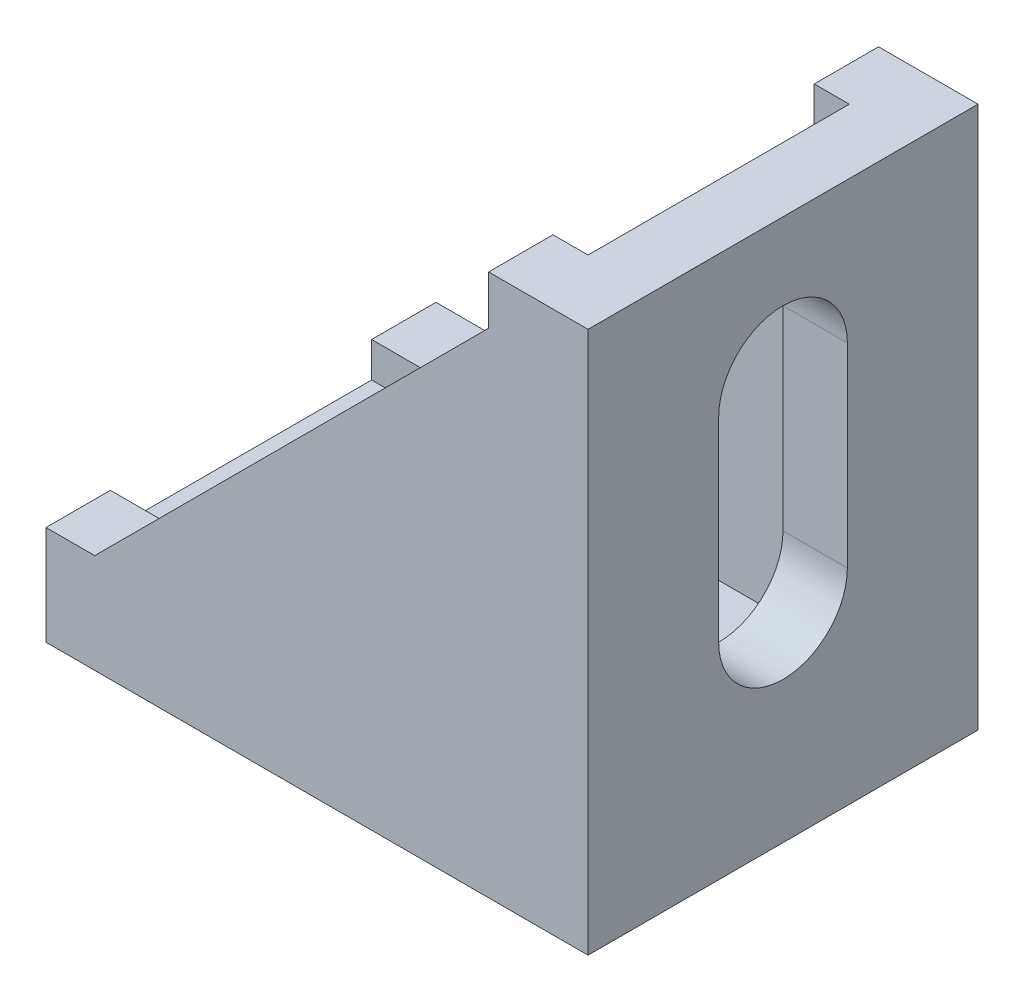
from build123d import *

# Parameters (mm, degrees)
SKETCH_2_W          = 27.8
SKETCH_2_H          = 20
EXTRUDE_1_DEPTH     = 3.3
EXTRUDE_2_DEPTH     = 24.5
CUT_EXTRUDE_1_DEPTH = 24.8
CUT_EXTRUDE_2_DEPTH = 24.8
CUT_EXTRUDE_3_DEPTH = 24.8


with BuildPart() as part:
    # 草图2 → 凸台-拉伸1 (new body)
    with BuildSketch(Plane(origin=(0, 0, 0), x_dir=(1, 0, 0), z_dir=(0, 1, 0))):
        Rectangle(SKETCH_2_W, SKETCH_2_H)
    extrude(amount=EXTRUDE_1_DEPTH)

    # 草图4 → 凸台-拉伸2 (add)
    with BuildSketch(Plane(origin=(0, 3.3, 0), x_dir=(1, 0, 0), z_dir=(0, 1, 0))):
        Polygon((-13.9, 10), (-13.9, 6.7), (10.6, 6.7), (10.6, -6.7), (-13.9, -6.7), (-13.9, -10), (13.9, -10), (13.9, 10), align=None)
    extrude(amount=EXTRUDE_2_DEPTH)

    # 草图5 → 切除-拉伸1 (cut)
    with BuildSketch(Plane.XY.offset(10)):
        Polygon((8.801548781, 27.8), (8.801548781, 25.3), (-11.4, 5.098451219), (-13.9, 5.098451219), (-13.9, 27.8), align=None)
    extrude(amount=-CUT_EXTRUDE_1_DEPTH, mode=Mode.SUBTRACT)

    # 草图6 → 切除-拉伸2 (cut)
    with BuildSketch(Plane.ZY.offset(-10.6)):
        with BuildLine():
            Line((-3.3, 20.55), (-3.3, 10.55))
            ThreePointArc((-3.3, 10.55), (0, 7.25), (3.3, 10.55))
            Line((3.3, 10.55), (3.3, 20.55))
            ThreePointArc((3.3, 20.55), (0, 23.85), (-3.3, 20.55))
        make_face()
    extrude(amount=-CUT_EXTRUDE_2_DEPTH, mode=Mode.SUBTRACT)

    # 草图7 → 切除-拉伸3 (cut)
    with BuildSketch(Plane(origin=(0, 3.3, 0), x_dir=(1, 0, 0), z_dir=(0, 1, 0))):
        with BuildLine():
            Line((3.35, 3.3), (-6.65, 3.3))
            ThreePointArc((-6.65, 3.3), (-9.95, 0), (-6.65, -3.3))
            Line((-6.65, -3.3), (3.35, -3.3))
            ThreePointArc((3.35, -3.3), (6.65, 0), (3.35, 3.3))
        make_face()
    extrude(amount=-CUT_EXTRUDE_3_DEPTH, mode=Mode.SUBTRACT)


solid = part.part
